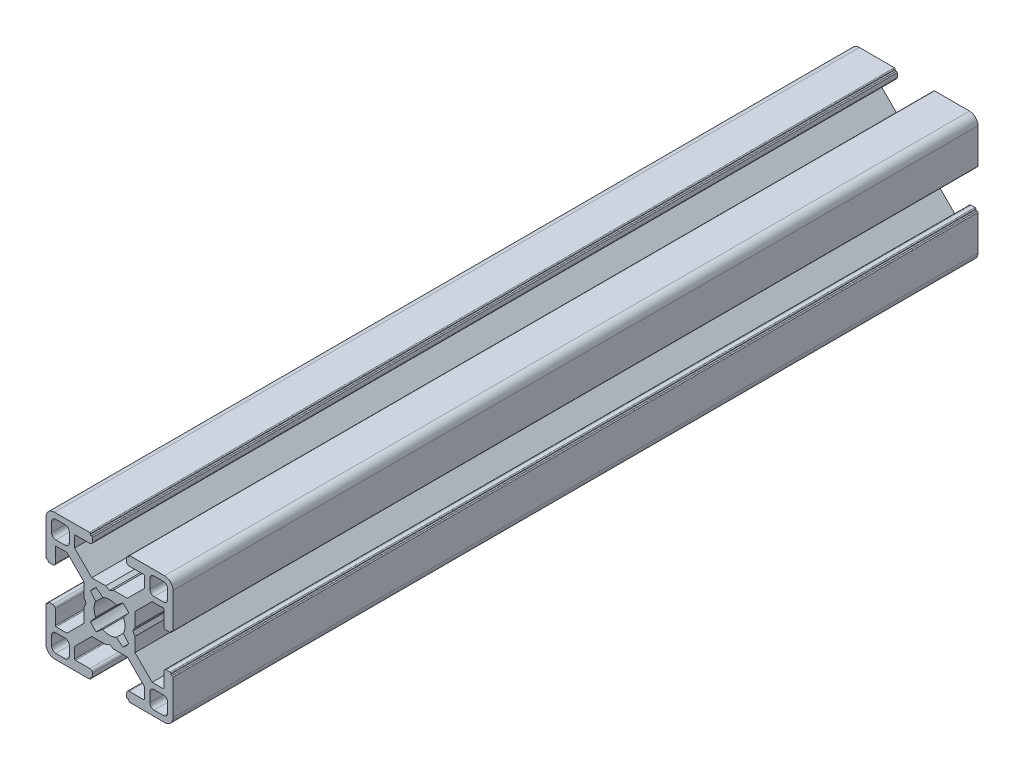
from build123d import *

# Parameters (mm, degrees)
BASE_EXTRUDE_DEPTH = 190


with BuildPart() as part:
    # Sketch1 → Base-Extrude (new body)
    with BuildSketch(Plane.XY):
        with BuildLine():
            Line((6.00446543, 0.899999619), (5.484852164, 0))
            Line((5.484852164, 0), (6.00446543, -0.899999619))
            Line((6.00446543, -0.899999619), (6.00446543, -4.204465866))
            Line((6.00446543, -4.204465866), (10.049999564, -8.25))
            Line((10.049999564, -8.25), (12.59999928, -8.25))
            ThreePointArc((12.59999928, -8.25), (12.741420837, -8.191421273), (12.799999564, -8.049999716))
            Line((12.799999564, -8.049999716), (12.799999564, -4.649999613))
            ThreePointArc((12.799999564, -4.649999613), (12.975735606, -4.225735278), (13.39999994, -4.049999237))
            Line((13.39999994, -4.049999237), (14.300000043, -4.049999237))
            ThreePointArc((14.300000043, -4.049999237), (14.4414216, -4.108577964), (14.500000327, -4.249999521))
            Line((14.500000327, -4.249999521), (14.500000327, -4.349998953))
            ThreePointArc((14.500000327, -4.349998953), (14.558579054, -4.49142051), (14.700000611, -4.549999237))
            Line((14.700000611, -4.549999237), (14.799999716, -4.549999237))
            ThreePointArc((14.799999716, -4.549999237), (14.941421273, -4.608577964), (15, -4.749999521))
            Line((15, -4.749999521), (15, -13.000000346))
            ThreePointArc((15, -13.000000346), (14.414213664, -14.414213664), (13.000000346, -15))
            Line((13.000000346, -15), (4.749999945, -15))
            ThreePointArc((4.749999945, -15), (4.60857832, -14.941421245), (4.549999564, -14.799999619))
            Line((4.549999564, -14.799999619), (4.549999564, -14.69999942))
            ThreePointArc((4.549999564, -14.69999942), (4.49142109, -14.558578474), (4.350000144, -14.5))
            Line((4.350000144, -14.5), (4.250000374, -14.5))
            ThreePointArc((4.250000374, -14.5), (4.108578753, -14.441421247), (4.05, -14.299999626))
            Line((4.05, -14.299999626), (4.05, -13.399999434))
            ThreePointArc((4.05, -13.399999434), (4.225735989, -12.975735226), (4.650000197, -12.799999237))
            Line((4.650000197, -12.799999237), (8.049999924, -12.799999237))
            ThreePointArc((8.049999924, -12.799999237), (8.191421565, -12.741420475), (8.250000327, -12.599998834))
            Line((8.250000327, -12.599998834), (8.250000327, -10.049999237))
            Line((8.250000327, -10.049999237), (4.204466193, -6))
            Line((4.204466193, -6), (0.899999946, -6))
            Line((0.899999946, -6), (0, -5.484851837))
            Line((0, -5.484851837), (-0.899999946, -6))
            Line((-0.899999946, -6), (-4.204466193, -6))
            Line((-4.204466193, -6), (-8.250000327, -10.049999237))
            Line((-8.250000327, -10.049999237), (-8.250000327, -12.599998834))
            ThreePointArc((-8.250000327, -12.599998834), (-8.191421565, -12.741420475), (-8.049999924, -12.799999237))
            Line((-8.049999924, -12.799999237), (-4.650000197, -12.799999237))
            ThreePointArc((-4.650000197, -12.799999237), (-4.225735989, -12.975735226), (-4.05, -13.399999434))
            Line((-4.05, -13.399999434), (-4.05, -14.299999626))
            ThreePointArc((-4.05, -14.299999626), (-4.108578753, -14.441421247), (-4.250000374, -14.5))
            Line((-4.250000374, -14.5), (-4.350000144, -14.5))
            ThreePointArc((-4.350000144, -14.5), (-4.49142109, -14.558578474), (-4.549999564, -14.69999942))
            Line((-4.549999564, -14.69999942), (-4.549999564, -14.799999619))
            ThreePointArc((-4.549999564, -14.799999619), (-4.60857832, -14.941421245), (-4.749999945, -15))
            Line((-4.749999945, -15), (-13.000000346, -15))
            ThreePointArc((-13.000000346, -15), (-14.414213664, -14.414213664), (-15, -13.000000346))
            Line((-15, -13.000000346), (-15, -4.749999521))
            ThreePointArc((-15, -4.749999521), (-14.941421273, -4.608577964), (-14.799999716, -4.549999237))
            Line((-14.799999716, -4.549999237), (-14.700000611, -4.549999237))
            ThreePointArc((-14.700000611, -4.549999237), (-14.558579054, -4.49142051), (-14.500000327, -4.349998953))
            Line((-14.500000327, -4.349998953), (-14.500000327, -4.249999521))
            ThreePointArc((-14.500000327, -4.249999521), (-14.4414216, -4.108577964), (-14.300000043, -4.049999237))
            Line((-14.300000043, -4.049999237), (-13.39999994, -4.049999237))
            ThreePointArc((-13.39999994, -4.049999237), (-12.975735606, -4.225735278), (-12.799999564, -4.649999613))
            Line((-12.799999564, -4.649999613), (-12.799999564, -8.049999716))
            ThreePointArc((-12.799999564, -8.049999716), (-12.741420837, -8.191421273), (-12.59999928, -8.25))
            Line((-12.59999928, -8.25), (-10.049999564, -8.25))
            Line((-10.049999564, -8.25), (-6.00446543, -4.204465866))
            Line((-6.00446543, -4.204465866), (-6.00446543, -0.899999619))
            Line((-6.00446543, -0.899999619), (-5.484852164, 0))
            Line((-5.484852164, 0), (-6.00446543, 0.899999619))
            Line((-6.00446543, 0.899999619), (-6.00446543, 4.204465866))
            Line((-6.00446543, 4.204465866), (-10.049999564, 8.25))
            Line((-10.049999564, 8.25), (-12.59999928, 8.25))
            ThreePointArc((-12.59999928, 8.25), (-12.741420837, 8.191421273), (-12.799999564, 8.049999716))
            Line((-12.799999564, 8.049999716), (-12.799999564, 4.649999613))
            ThreePointArc((-12.799999564, 4.649999613), (-12.975735606, 4.225735278), (-13.39999994, 4.049999237))
            Line((-13.39999994, 4.049999237), (-14.300000043, 4.049999237))
            ThreePointArc((-14.300000043, 4.049999237), (-14.4414216, 4.108577964), (-14.500000327, 4.249999521))
            Line((-14.500000327, 4.249999521), (-14.500000327, 4.349998953))
            ThreePointArc((-14.500000327, 4.349998953), (-14.558579054, 4.49142051), (-14.700000611, 4.549999237))
            Line((-14.700000611, 4.549999237), (-14.799999716, 4.549999237))
            ThreePointArc((-14.799999716, 4.549999237), (-14.941421273, 4.608577964), (-15, 4.749999521))
            Line((-15, 4.749999521), (-15, 13.000000346))
            ThreePointArc((-15, 13.000000346), (-14.414213664, 14.414213664), (-13.000000346, 15))
            Line((-13.000000346, 15), (-4.749999945, 15))
            ThreePointArc((-4.749999945, 15), (-4.60857832, 14.941421245), (-4.549999564, 14.799999619))
            Line((-4.549999564, 14.799999619), (-4.549999564, 14.69999942))
            ThreePointArc((-4.549999564, 14.69999942), (-4.49142109, 14.558578474), (-4.350000144, 14.5))
            Line((-4.350000144, 14.5), (-4.250000374, 14.5))
            ThreePointArc((-4.250000374, 14.5), (-4.108578753, 14.441421247), (-4.05, 14.299999626))
            Line((-4.05, 14.299999626), (-4.05, 13.399999434))
            ThreePointArc((-4.05, 13.399999434), (-4.225735989, 12.975735226), (-4.650000197, 12.799999237))
            Line((-4.650000197, 12.799999237), (-8.049999924, 12.799999237))
            ThreePointArc((-8.049999924, 12.799999237), (-8.191421565, 12.741420475), (-8.250000327, 12.599998834))
            Line((-8.250000327, 12.599998834), (-8.250000327, 10.049999237))
            Line((-8.250000327, 10.049999237), (-4.204466193, 6))
            Line((-4.204466193, 6), (-0.899999946, 6))
            Line((-0.899999946, 6), (0, 5.484851837))
            Line((0, 5.484851837), (0.899999946, 6))
            Line((0.899999946, 6), (4.204466193, 6))
            Line((4.204466193, 6), (8.250000327, 10.049999237))
            Line((8.250000327, 10.049999237), (8.250000327, 12.599998834))
            ThreePointArc((8.250000327, 12.599998834), (8.191421565, 12.741420475), (8.049999924, 12.799999237))
            Line((8.049999924, 12.799999237), (4.650000197, 12.799999237))
            ThreePointArc((4.650000197, 12.799999237), (4.225735989, 12.975735226), (4.05, 13.399999434))
            Line((4.05, 13.399999434), (4.05, 14.299999626))
            ThreePointArc((4.05, 14.299999626), (4.108578753, 14.441421247), (4.250000374, 14.5))
            Line((4.250000374, 14.5), (4.350000144, 14.5))
            ThreePointArc((4.350000144, 14.5), (4.49142109, 14.558578474), (4.549999564, 14.69999942))
            Line((4.549999564, 14.69999942), (4.549999564, 14.799999619))
            ThreePointArc((4.549999564, 14.799999619), (4.60857832, 14.941421245), (4.749999945, 15))
            Line((4.749999945, 15), (13.000000346, 15))
            ThreePointArc((13.000000346, 15), (14.414213664, 14.414213664), (15, 13.000000346))
            Line((15, 13.000000346), (15, 4.749999521))
            ThreePointArc((15, 4.749999521), (14.941421273, 4.608577964), (14.799999716, 4.549999237))
            Line((14.799999716, 4.549999237), (14.700000611, 4.549999237))
            ThreePointArc((14.700000611, 4.549999237), (14.558579054, 4.49142051), (14.500000327, 4.349998953))
            Line((14.500000327, 4.349998953), (14.500000327, 4.249999521))
            ThreePointArc((14.500000327, 4.249999521), (14.4414216, 4.108577964), (14.300000043, 4.049999237))
            Line((14.300000043, 4.049999237), (13.39999994, 4.049999237))
            ThreePointArc((13.39999994, 4.049999237), (12.975735606, 4.225735278), (12.799999564, 4.649999613))
            Line((12.799999564, 4.649999613), (12.799999564, 8.049999716))
            ThreePointArc((12.799999564, 8.049999716), (12.741420837, 8.191421273), (12.59999928, 8.25))
            Line((12.59999928, 8.25), (10.049999564, 8.25))
            Line((10.049999564, 8.25), (6.00446543, 4.204465866))
            Line((6.00446543, 4.204465866), (6.00446543, 0.899999619))
        make_face()
        with BuildLine():
            Line((13.70000109, 12.700000398), (13.70000109, 10.499999635))
            ThreePointArc((13.70000109, 10.499999635), (13.407107874, 9.792892851), (12.70000109, 9.499999635))
            Line((12.70000109, 9.499999635), (10.500000327, 9.499999635))
            ThreePointArc((10.500000327, 9.499999635), (9.792893543, 9.792892851), (9.500000327, 10.499999635))
            Line((9.500000327, 10.499999635), (9.500000327, 12.700000398))
            ThreePointArc((9.500000327, 12.700000398), (9.792893543, 13.407107182), (10.500000327, 13.700000398))
            Line((10.500000327, 13.700000398), (12.70000109, 13.700000398))
            ThreePointArc((12.70000109, 13.700000398), (13.407107874, 13.407107182), (13.70000109, 12.700000398))
        make_face(mode=Mode.SUBTRACT)
        with BuildLine():
            Line((3.135929412, 4.518400903), (1.600129524, 3.280561767))
            ThreePointArc((1.600129524, 3.280561767), (0, 3.65), (-1.600129524, 3.280561767))
            Line((-1.600129524, 3.280561767), (-3.135929412, 4.518400903))
            ThreePointArc((-3.135929412, 4.518400903), (-3.881002259, 3.897155561), (-4.505336892, 3.154669473))
            Line((-4.505336892, 3.154669473), (-3.280561732, 1.600129597))
            ThreePointArc((-3.280561732, 1.600129597), (-3.65, 0), (-3.280561732, -1.600129597))
            Line((-3.280561732, -1.600129597), (-4.505336892, -3.154669473))
            ThreePointArc((-4.505336892, -3.154669473), (-3.881002259, -3.897155561), (-3.135929412, -4.518400903))
            Line((-3.135929412, -4.518400903), (-1.600129524, -3.280561767))
            ThreePointArc((-1.600129524, -3.280561767), (0, -3.65), (1.600129524, -3.280561767))
            Line((1.600129524, -3.280561767), (3.135929412, -4.518400903))
            ThreePointArc((3.135929412, -4.518400903), (3.881002259, -3.897155561), (4.505336892, -3.154669473))
            Line((4.505336892, -3.154669473), (3.280561732, -1.600129597))
            ThreePointArc((3.280561732, -1.600129597), (3.65, 0), (3.280561732, 1.600129597))
            Line((3.280561732, 1.600129597), (4.505336892, 3.154669473))
            ThreePointArc((4.505336892, 3.154669473), (3.881002259, 3.897155561), (3.135929412, 4.518400903))
        make_face(mode=Mode.SUBTRACT)
        with BuildLine():
            Line((-13.70000109, -12.700000398), (-13.70000109, -10.499999635))
            ThreePointArc((-13.70000109, -10.499999635), (-13.407107874, -9.792892851), (-12.70000109, -9.499999635))
            Line((-12.70000109, -9.499999635), (-10.500000327, -9.499999635))
            ThreePointArc((-10.500000327, -9.499999635), (-9.792893543, -9.792892851), (-9.500000327, -10.499999635))
            Line((-9.500000327, -10.499999635), (-9.500000327, -12.700000398))
            ThreePointArc((-9.500000327, -12.700000398), (-9.792893543, -13.407107182), (-10.500000327, -13.700000398))
            Line((-10.500000327, -13.700000398), (-12.70000109, -13.700000398))
            ThreePointArc((-12.70000109, -13.700000398), (-13.407107874, -13.407107182), (-13.70000109, -12.700000398))
        make_face(mode=Mode.SUBTRACT)
        with BuildLine():
            Line((10.500000327, -13.700000398), (12.70000109, -13.700000398))
            ThreePointArc((12.70000109, -13.700000398), (13.407107874, -13.407107182), (13.70000109, -12.700000398))
            Line((13.70000109, -12.700000398), (13.70000109, -10.499999635))
            ThreePointArc((13.70000109, -10.499999635), (13.407107874, -9.792892851), (12.70000109, -9.499999635))
            Line((12.70000109, -9.499999635), (10.500000327, -9.499999635))
            ThreePointArc((10.500000327, -9.499999635), (9.792893543, -9.792892851), (9.500000327, -10.499999635))
            Line((9.500000327, -10.499999635), (9.500000327, -12.700000398))
            ThreePointArc((9.500000327, -12.700000398), (9.792893543, -13.407107182), (10.500000327, -13.700000398))
        make_face(mode=Mode.SUBTRACT)
        with BuildLine():
            Line((-10.500000327, 13.700000398), (-12.70000109, 13.700000398))
            ThreePointArc((-12.70000109, 13.700000398), (-13.407107874, 13.407107182), (-13.70000109, 12.700000398))
            Line((-13.70000109, 12.700000398), (-13.70000109, 10.499999635))
            ThreePointArc((-13.70000109, 10.499999635), (-13.407107874, 9.792892851), (-12.70000109, 9.499999635))
            Line((-12.70000109, 9.499999635), (-10.500000327, 9.499999635))
            ThreePointArc((-10.500000327, 9.499999635), (-9.792893543, 9.792892851), (-9.500000327, 10.499999635))
            Line((-9.500000327, 10.499999635), (-9.500000327, 12.700000398))
            ThreePointArc((-9.500000327, 12.700000398), (-9.792893543, 13.407107182), (-10.500000327, 13.700000398))
        make_face(mode=Mode.SUBTRACT)
    extrude(amount=-BASE_EXTRUDE_DEPTH)


solid = part.part
